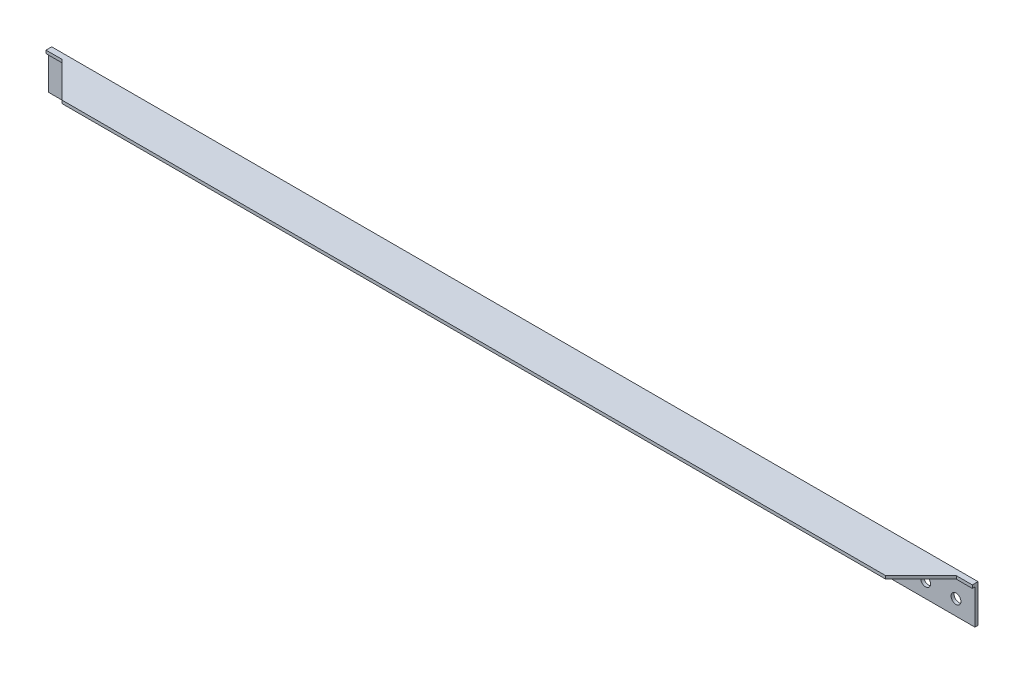
from build123d import *

# Parameters (mm, degrees)
SKETCH_1_W          = 2440
SKETCH_1_H          = 100
SKETCH_1_R          = 13
EXTRUDE_710_DEPTH   = 8
SKETCH_2_W          = 2440
SKETCH_2_H          = 8
EXTRUDE_1_DEPTH     = 100
CUT_EXTRUDE_1_DEPTH = 1229.846613699


with BuildPart() as part:
    # 草图1 → Extrude 710 (new body)
    with BuildSketch(Plane.XY):
        with Locations((0, 50)):
            Rectangle(SKETCH_1_W, SKETCH_1_H)
        with Locations((1090, 40)):
            Circle(SKETCH_1_R, mode=Mode.SUBTRACT)
        with Locations((1170, 40)):
            Circle(SKETCH_1_R, mode=Mode.SUBTRACT)
        with Locations(Location((-1170, 40, 0), (0, 0, 180))):
            Circle(SKETCH_1_R, mode=Mode.SUBTRACT)
        with Locations(Location((-1090, 40, 0), (0, 0, 180))):
            Circle(SKETCH_1_R, mode=Mode.SUBTRACT)
        with Locations((0, 40)):
            Circle(SKETCH_1_R, mode=Mode.SUBTRACT)
        with Locations((80, 40)):
            Circle(SKETCH_1_R, mode=Mode.SUBTRACT)
        with Locations((160, 40)):
            Circle(SKETCH_1_R, mode=Mode.SUBTRACT)
        with Locations(Location((-160, 40, 0), (0, 0, 180))):
            Circle(SKETCH_1_R, mode=Mode.SUBTRACT)
        with Locations(Location((-80, 40, 0), (0, 0, 180))):
            Circle(SKETCH_1_R, mode=Mode.SUBTRACT)
    extrude(amount=EXTRUDE_710_DEPTH)

    # 草图2 → 凸台-拉伸1 (add)
    with BuildSketch(Plane.XY.offset(8)):
        with Locations((0, 96)):
            Rectangle(SKETCH_2_W, SKETCH_2_H)
    extrude(amount=EXTRUDE_1_DEPTH)

    # 草图3 → 切除-拉伸1 (cut, through all)
    with BuildSketch(Plane(origin=(0, 100, 0), x_dir=(-1, 0, 0), z_dir=(0, 1, 0))):
        Polygon((-1085, 108), (-1178, 15), (-1220, 15), (-1220, 108), align=None)
        Polygon((1220, 15), (1178, 15), (1085, 108), (1220, 108), align=None)
    extrude(amount=-CUT_EXTRUDE_1_DEPTH, mode=Mode.SUBTRACT)


solid = part.part
